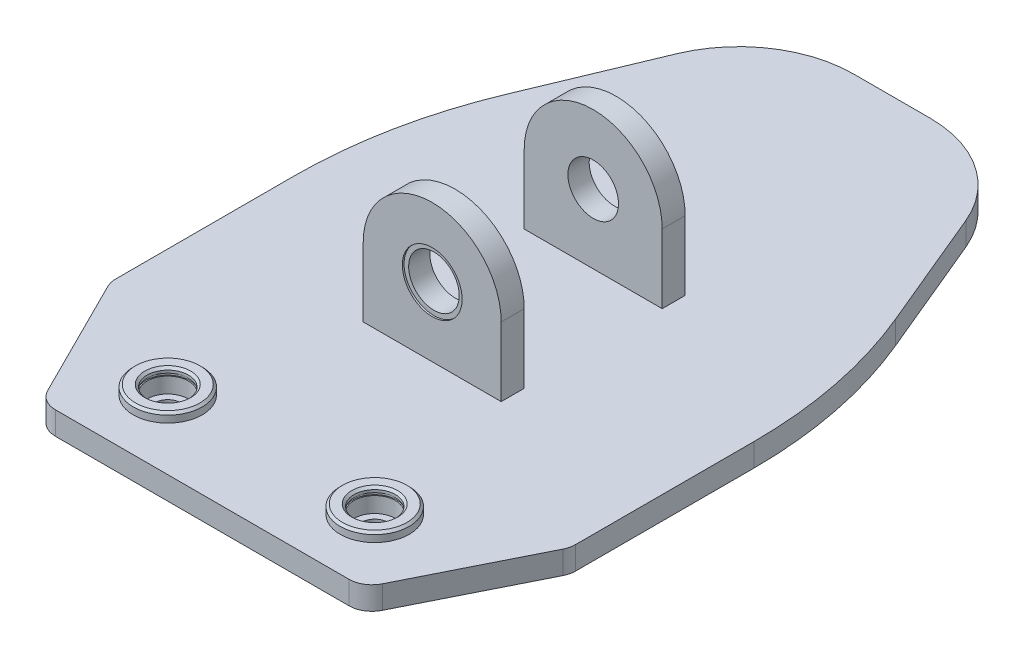
from build123d import *

# Parameters (mm, degrees)
EXTRUDE_1_DEPTH            = 10
EXTRUDE_START              = -100
EXTRUDE_3_DEPTH            = 80
SKETCH_5_W                 = 80
SKETCH_5_H                 = 60
CUT_EXTRUDE_2_DEPTH        = 110
FILLET_1_R                 = 50
FILLET_2_R                 = 200
SKETCH_7_R                 = 9
CUT_EXTRUDE_6_DEPTH        = 6
SKETCH_10_R                = 6
CUT_EXTRUDE_7_DEPTH        = 28
SKETCH_12_R                = 15
EXTRUDE_5_DEPTH            = 4
SKETCH_13_R                = 9
CUT_EXTRUDE_9_DEPTH        = 4
CUT_EXTRUDE_START          = -2.15
SKETCH_14_R                = 9.5
CUT_EXTRUDE_4117_DEPTH     = 1.1
CHAMFER_1_SIZE             = 1
CHAMFER_1_OF_MIRROR_1_SIZE = 1
SKETCH_16_R                = 13
CUT_EXTRUDE_10_DEPTH       = 0.75
CUT_EXTRUDE_START_2        = -0.75
SKETCH_17_R                = 13
CUT_EXTRUDE_11_DEPTH       = 0.75
CHAMFER_2_SIZE             = 30
CHAMFER_2_SIZE2            = 60
CHAMFER_3_SIZE             = 60
CHAMFER_3_SIZE2            = 30
FILLET_3_R                 = 10


with BuildPart() as part:
    # 草图1 → 凸台-拉伸1 (new body)
    with BuildSketch(Plane(origin=(0, 0, 0), x_dir=(1, 0, 0), z_dir=(0, 1, 0))):
        Polygon((-100, 0), (100, 0), (100, 180), (50, 300), (-50, 300), (-100, 180), align=None)
    extrude(amount=EXTRUDE_1_DEPTH)

    # 草图4 → 凸台-拉伸3 (add)
    with BuildSketch(Plane.XY.offset(EXTRUDE_START)):
        with BuildLine():
            Line((0, 29), (0, 10))
            Line((0, 10), (30, 10))
            Line((30, 10), (30, 40))
            ThreePointArc((30, 40), (21.213203436, 61.213203436), (0, 70))
            Line((0, 70), (0, 51))
            ThreePointArc((0, 51), (7.778174593, 47.778174593), (11, 40))
            ThreePointArc((11, 40), (7.778174593, 32.221825407), (0, 29))
        make_face()
        with BuildLine():
            Line((-30, 10), (0, 10))
            Line((0, 10), (0, 29))
            ThreePointArc((0, 29), (-11, 40), (0, 51))
            Line((0, 51), (0, 70))
            ThreePointArc((0, 70), (-21.213203436, 61.213203436), (-30, 40))
            Line((-30, 40), (-30, 10))
        make_face()
    extrude(amount=-EXTRUDE_3_DEPTH)

    # 草图5 → 切除-拉伸2 (cut)
    with BuildSketch(Plane(origin=(0, 10, 0), x_dir=(1, 0, 0), z_dir=(0, 1, 0))):
        with Locations((0, 140)):
            Rectangle(SKETCH_5_W, SKETCH_5_H)
    extrude(amount=CUT_EXTRUDE_2_DEPTH, mode=Mode.SUBTRACT)

    # 圆角1
    fillet_1_edges = [part.edges().sort_by_distance(p)[0] for p in [
        (-50, 5, -300),
        (50, 5, -300),
    ]]
    fillet(fillet_1_edges, radius=FILLET_1_R)

    # 圆角2
    fillet_2_edges = [part.edges().sort_by_distance(p)[0] for p in [
        (-100, 5, -180),
        (100, 5, -180),
    ]]
    fillet(fillet_2_edges, radius=FILLET_2_R)

    # 草图7 → 切除-拉伸6 (cut)
    with BuildSketch(Plane(origin=(0, 10, 0), x_dir=(1, 0, 0), z_dir=(0, 1, 0))):
        with Locations(Location((45, 30, 0), (0, 0, 270))):
            Circle(SKETCH_7_R)
    cut_extrude_6 = extrude(amount=-CUT_EXTRUDE_6_DEPTH, mode=Mode.SUBTRACT)

    # 草图10 → 切除-拉伸7 (cut)
    with BuildSketch(Plane(origin=(0, 4, 0), x_dir=(1, 0, 0), z_dir=(0, 1, 0))):
        with Locations(Location((45, 30, 0), (0, 0, 270))):
            Circle(SKETCH_10_R)
    cut_extrude_7 = extrude(amount=-CUT_EXTRUDE_7_DEPTH, mode=Mode.SUBTRACT)

    # 草图12 → 凸台-拉伸5 (add)
    with BuildSketch(Plane(origin=(0, 10, 0), x_dir=(1, 0, 0), z_dir=(0, 1, 0))):
        with Locations(Location((45, 30, 0), (0, 0, 270))):
            Circle(SKETCH_12_R)
    extrude_5 = extrude(amount=EXTRUDE_5_DEPTH)

    # 草图13 → 切除-拉伸9 (cut)
    with BuildSketch(Plane(origin=(0, 14, 0), x_dir=(1, 0, 0), z_dir=(0, 1, 0))):
        with Locations(Location((45, 30, 0), (0, 0, 270))):
            Circle(SKETCH_13_R)
    cut_extrude_9 = extrude(amount=-CUT_EXTRUDE_9_DEPTH, mode=Mode.SUBTRACT)

    # 草图14 → Cut-Extrude 4117 (cut)
    with BuildSketch(Plane(origin=(0, 14, 0), x_dir=(1, 0, 0), z_dir=(0, 1, 0)).offset(CUT_EXTRUDE_START)):
        with Locations(Location((45, 30, 0), (0, 0, 270))):
            Circle(SKETCH_14_R)
    cut_extrude_4117 = extrude(amount=-CUT_EXTRUDE_4117_DEPTH, mode=Mode.SUBTRACT)

    # 倒角1
    chamfer_1_edges = [part.edges().sort_by_distance(p)[0] for p in [
        (45, 14, -45),
        (45, 14, -39),
    ]]
    chamfer(chamfer_1_edges, length=CHAMFER_1_SIZE)

    # 镜向1: 切除-拉伸6, 切除-拉伸7, 凸台-拉伸5, 切除-拉伸9, Cut-Extrude 4117 across plane
    add(cut_extrude_6.mirror(Plane.ZY), mode=Mode.SUBTRACT)
    add(cut_extrude_7.mirror(Plane.ZY), mode=Mode.SUBTRACT)
    add(extrude_5.mirror(Plane.ZY))
    add(cut_extrude_9.mirror(Plane.ZY), mode=Mode.SUBTRACT)
    add(cut_extrude_4117.mirror(Plane.ZY), mode=Mode.SUBTRACT)

    # 倒角1 of 镜向1
    chamfer_1_of_mirror_1_edges = [part.edges().sort_by_distance(p)[0] for p in [
        (-45, 14, -45),
        (-45, 14, -39),
    ]]
    chamfer(chamfer_1_of_mirror_1_edges, length=CHAMFER_1_OF_MIRROR_1_SIZE)

    # 草图16 → 切除-拉伸10 (cut)
    with BuildSketch(Plane.XY.offset(-100)):
        with Locations((0, 40)):
            Circle(SKETCH_16_R)
    extrude(amount=-CUT_EXTRUDE_10_DEPTH, mode=Mode.SUBTRACT)

    # 草图17 → 切除-拉伸11 (cut)
    with BuildSketch(Plane(origin=(0, 0, -180), x_dir=(-1, 0, 0), z_dir=(0, 0, -1)).offset(CUT_EXTRUDE_START_2)):
        with Locations(Location((0, 40, 0), (0, 0, 180))):
            Circle(SKETCH_17_R)
    extrude(amount=CUT_EXTRUDE_11_DEPTH, mode=Mode.SUBTRACT)

    # 倒角2
    chamfer_2_edges = [part.edges().sort_by_distance(p)[0] for p in [
        (100, 5, 0),
    ]]
    chamfer_2_side = [part.faces().sort_by_distance(p)[0] for p in [
        (0, 5, 0),
    ]]
    chamfer(chamfer_2_edges, length=CHAMFER_2_SIZE, length2=CHAMFER_2_SIZE2, reference=chamfer_2_side[0])

    # 倒角3
    chamfer_3_edges = [part.edges().sort_by_distance(p)[0] for p in [
        (-100, 5, 0),
    ]]
    chamfer_3_side = [part.faces().sort_by_distance(p)[0] for p in [
        (-100, 5, -70),
    ]]
    chamfer(chamfer_3_edges, length=CHAMFER_3_SIZE, length2=CHAMFER_3_SIZE2, reference=chamfer_3_side[0])

    # 圆角3
    fillet_3_edges = [part.edges().sort_by_distance(p)[0] for p in [
        (100, 5, -60),
        (70, 5, 0),
        (-70, 5, 0),
        (-100, 5, -60),
    ]]
    fillet(fillet_3_edges, radius=FILLET_3_R)


solid = part.part
